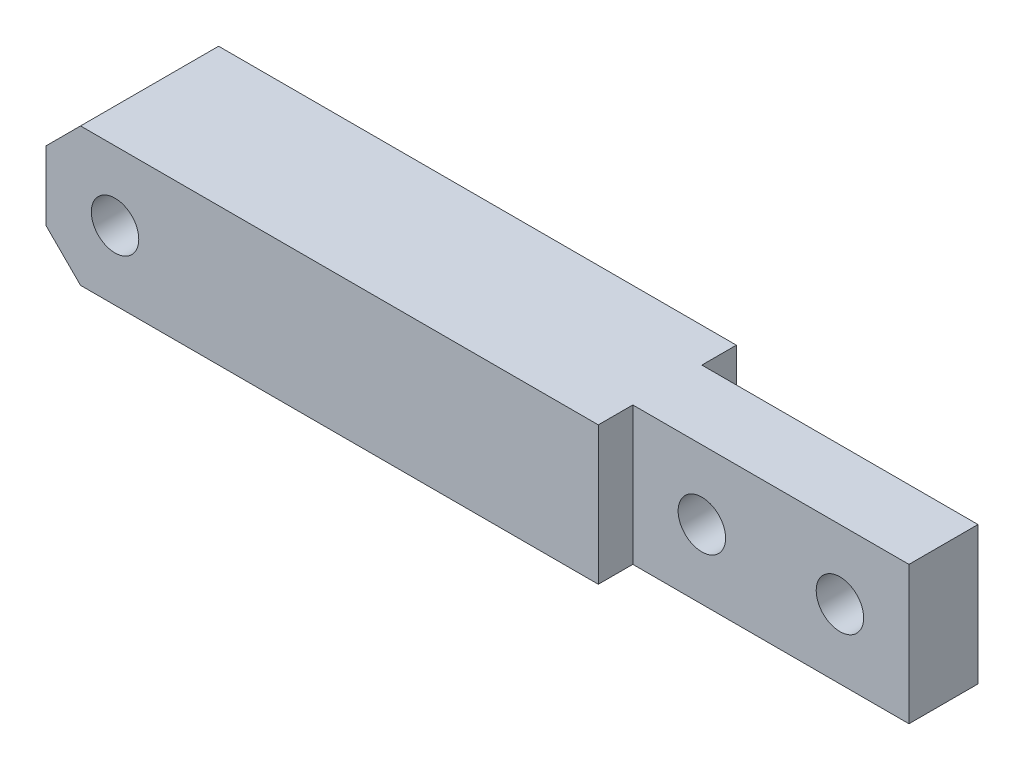
from build123d import *

# Parameters (mm, degrees)
BOSS_EXTRUDE1_DEPTH     = 6.35
CUT_EXTRUDE1_DEPTH      = 78.51162816
CUT_EXTRUDE1_DEPTH_BACK = 78.51162816
SKETCH2_R               = 2.1828125
CHAMFER1_SIZE           = 3.175


with BuildPart() as part:
    # Sketch1 → Boss-Extrude1 (new, symmetric)
    with BuildSketch(Plane(origin=(0, 0, 0), x_dir=(1, 0, 0), z_dir=(0, 1, 0))):
        Polygon((0, 0), (50.8, 0), (50.8, 3.175), (76.2, 3.175), (76.2, 9.525), (50.8, 9.525), (50.8, 12.7), (0, 12.7), align=None)
    extrude(amount=BOSS_EXTRUDE1_DEPTH, both=True)

    # Sketch2 → Cut-Extrude1 (cut, two sides: drawn at the far end of the back side and taken through both)
    with BuildSketch(Plane.XY.offset(-CUT_EXTRUDE1_DEPTH_BACK)):
        with Locations((6.35, 0)):
            Circle(SKETCH2_R)
        with Locations((57.15, 0)):
            Circle(SKETCH2_R)
        with Locations((69.85, 0)):
            Circle(SKETCH2_R)
    extrude(amount=CUT_EXTRUDE1_DEPTH + CUT_EXTRUDE1_DEPTH_BACK, mode=Mode.SUBTRACT)

    # Chamfer1
    chamfer1_edges = [part.edges().sort_by_distance(p)[0] for p in [
        (0, -6.35, -6.35),
        (0, 6.35, -6.35),
    ]]
    chamfer(chamfer1_edges, length=CHAMFER1_SIZE)


solid = part.part
